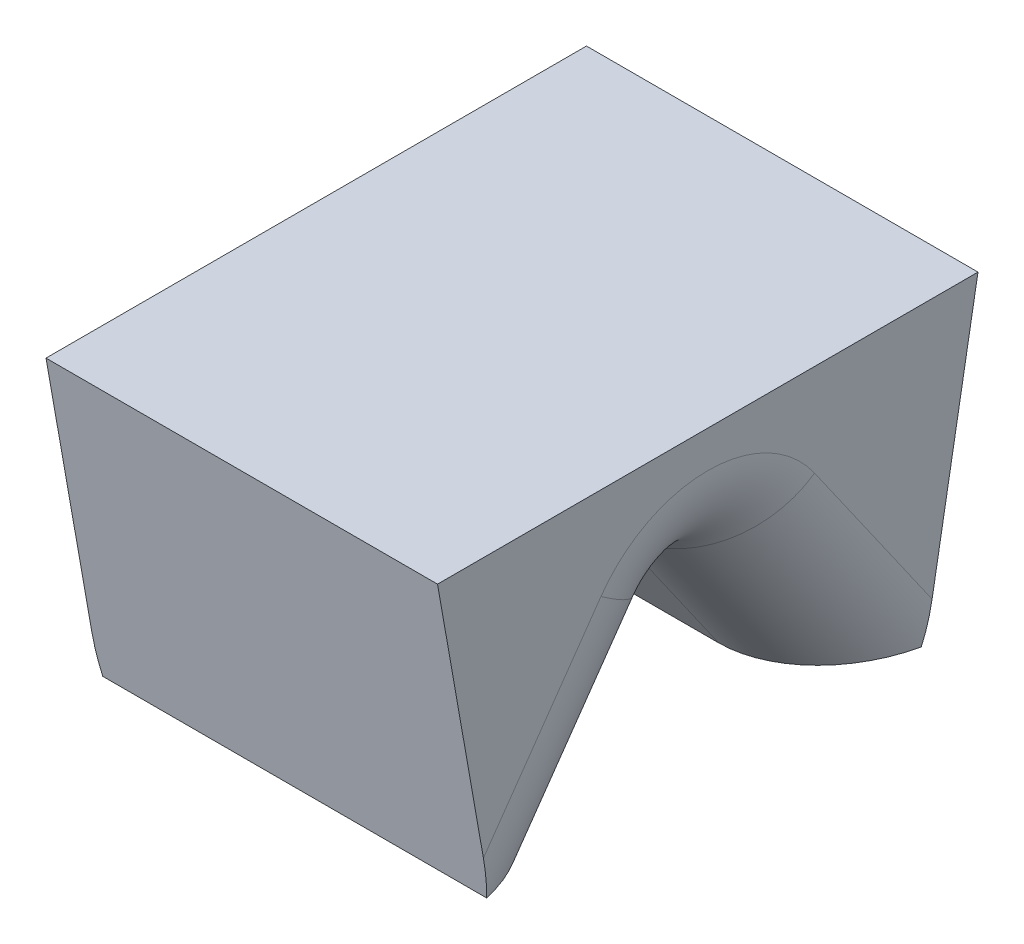
from build123d import *

# Parameters (mm, degrees)
SKETCH_TL_CUTTING_R    = 1.4986
TL_CUTTING_DEPTH       = 29.999999944
SKETCH_TDF_CUTTING_W   = 3.01719996
SKETCH_TDF_CUTTING_H   = 3.01719996
TDF_CUTTING_DEPTH      = 31.074766841
VW_VR_GRINDING_DEPTH   = 1.50859998
VW_VR_GRINDING_2_DEPTH = 1.50859998
ISA_GRINDING_DEPTH     = 1.50859998
SKETCH_PRE_FRX_BRX_W   = 1.220380084
SKETCH_PRE_FRX_BRX_H   = 0.82042
SKETCH_PRE_FRX_BRX_W_2 = 1.24681996
PRE_FRX_BRX_DEPTH      = 1.50859998
FA_BA_GRINDING_DEPTH   = 1.50859998
BR_EDM_R               = 0.14986
FR_EDM_R               = 0.14986
ENGRAVING_DEPTH        = 0.005


with BuildPart() as part:
    # sketch_TL_cutting → TL_cutting (new body)
    with BuildSketch(Plane(origin=(0, 0, 0), x_dir=(1, 0, 0), z_dir=(0, 1, 0))):
        with Locations(Location((0, 0, 0), (0, 0, 270))):
            Circle(SKETCH_TL_CUTTING_R)
    extrude(amount=TL_CUTTING_DEPTH)

    # sketch_TDF_cutting → TDF_cutting (cut, through all)
    with BuildSketch(Plane(origin=(0, 0, 0), x_dir=(1, 0, 0), z_dir=(0, 1, 0))):
        with Locations((-2.71001998, 0)):
            Rectangle(SKETCH_TDF_CUTTING_W, SKETCH_TDF_CUTTING_H)
    extrude(amount=TDF_CUTTING_DEPTH, mode=Mode.SUBTRACT)


with BuildPart() as body_2:
    # sketch_VW_VR_grinding → VW_VR_grinding (new, symmetric)
    with BuildSketch(Plane(origin=(0, 0, 0), x_dir=(0, 0, -1), z_dir=(1, 0, 0))):
        with BuildLine():
            Line((-1.49360001, -0.00999998), (-1.49360001, 0.809308914))
            ThreePointArc((-1.49360001, 0.809308914), (-1.493648337, 0.810415792), (-1.493792952, 0.811514246))
            Line((-1.493792952, 0.811514246), (-1.51859996, 0.952201782))
            Line((-1.51859996, 0.952201782), (-1.50859998, -0.00999998))
            Line((-1.50859998, -0.00999998), (-1.49360001, -0.00999998))
        make_face()
    extrude(amount=VW_VR_GRINDING_DEPTH, both=True)


with BuildPart() as body_3:
    # sketch_VW_VR_grinding → VW_VR_grinding 2 (new, symmetric)
    with BuildSketch(Plane(origin=(0, 0, 0), x_dir=(0, 0, -1), z_dir=(1, 0, 0))):
        with BuildLine():
            Line((1.49360001, -0.00999998), (1.49360001, 0.809308914))
            ThreePointArc((1.49360001, 0.809308914), (1.493648337, 0.810415792), (1.493792952, 0.811514246))
            Line((1.493792952, 0.811514246), (1.51859996, 0.952201782))
            Line((1.51859996, 0.952201782), (1.50859998, -0.00999998))
            Line((1.50859998, -0.00999998), (1.49360001, -0.00999998))
        make_face()
    extrude(amount=VW_VR_GRINDING_2_DEPTH, both=True)


    add(body_2.part)  # ISA_grinding merges body 2
    # sketch_ISA_grinding → ISA_grinding (add, symmetric)
    with BuildSketch(Plane(origin=(0, 0, 0), x_dir=(0, 0, -1), z_dir=(1, 0, 0))):
        Polygon((-0.29972, 0), (0.29972, 0), (1.50859998, 6.855899053), (1.50859998, -0.02999994), (-1.50859998, -0.02999994), (-1.50859998, 6.855899053), align=None)
    extrude(amount=ISA_GRINDING_DEPTH, both=True)

    # sketch_pre_FRX_BRX → pre_FRX_BRX (add, symmetric)
    with BuildSketch(Plane.XY):
        with Locations((0.888409958, 0.40021002)):
            Rectangle(SKETCH_PRE_FRX_BRX_W, SKETCH_PRE_FRX_BRX_H)
        with Locations((-0.89518998, 0.40021002)):
            Rectangle(SKETCH_PRE_FRX_BRX_W_2, SKETCH_PRE_FRX_BRX_H)
    extrude(amount=PRE_FRX_BRX_DEPTH, both=True)

    # sketch_FA_BA_grinding → FA_BA_grinding (add, symmetric)
    with BuildSketch(Plane.XY):
        Polygon((0.268219936, -0.00999998), (0.268219936, 0.82042), (1.6256, 10.478681009), (1.6256, -0.00999998), align=None)
        Polygon((-0.27178, -0.00999998), (-0.27178, 0.82042), (-1.32842, 8.338804263), (-1.32842, -0.00999998), align=None)
    extrude(amount=FA_BA_GRINDING_DEPTH, both=True)


with BuildPart() as part_1:
    add(part.part)

    # B1_fix: cut body 3
    add(body_3.part, mode=Mode.SUBTRACT)

    # V-Groove_EDM: sweep along a path in sketch_contour_V-Groove
    with BuildLine(Plane.XY) as v_groove_edm_path:
        Line((-1.20142, 0.21336), (1.4986, 0.21336))
    # sketch_section_V-Groove → V-Groove_EDM (sweep, cut)
    with BuildSketch(Plane(origin=(-1.20142, 0, -1.2954), x_dir=(0, 0, -1), z_dir=(1, 0, 0))):
        with BuildLine():
            Line((-1.270850039, 0.200580099), (-1.12340028, -0.00999998))
            Line((-1.12340028, -0.00999998), (-1.46739972, -0.00999998))
            Line((-1.46739972, -0.00999998), (-1.319949961, 0.200580099))
            ThreePointArc((-1.319949961, 0.200580099), (-1.2954, 0.21336), (-1.270850039, 0.200580099))
        make_face()
    sweep(path=v_groove_edm_path.line, mode=Mode.SUBTRACT)

    # BR_EDM
    br_edm_edges = [part_1.edges().sort_by_distance(p)[0] for p in [
        (-0.27178, 0.21336, 0),
        (-0.27178, 0.10029005, -0.094773809),
        (-0.27178, 0.10029005, 0.094773809),
    ]]
    fillet(br_edm_edges, radius=BR_EDM_R)

    # FR_EDM
    fr_edm_edges = [part_1.edges().sort_by_distance(p)[0] for p in [
        (0.268219936, 0.10029005, -0.094773809),
        (0.268219936, 0.10029005, 0.094773809),
        (0.268219936, 0.21336, 0),
    ]]
    fillet(fr_edm_edges, radius=FR_EDM_R)

    # sketch_Engraving → Engraving (cut)
    with BuildSketch(Plane.ZY.offset(1.20142)):
        Polygon((-0.347748486, 0.295081019), (-0.475308325, 0.169076788), (-0.664833208, 0.042294753), (-0.91554533, -0.085524354), (-1.231852248, -0.147489398), (-1.486194122, -0.147489398), (-1.802501039, -0.085524354), (-2.055028038, 0.042294753), (-2.24455292, 0.169076788), (-2.372112759, 0.295081019), (-2.35033425, 0.316081724), (-2.227181966, 0.191114565), (-2.041027567, 0.06692521), (-1.791871053, -0.056486342), (-1.48256437, -0.119488457), (-1.235481999, -0.119488457), (-0.926175317, -0.056486342), (-0.678833678, 0.06692521), (-0.492679279, 0.191114565), (-0.369526995, 0.316081724), align=None)
    extrude(amount=-ENGRAVING_DEPTH, mode=Mode.SUBTRACT)

    # SurfaceCut1
    split(bisect_by=Plane(origin=(0, 0.41401793, 0), x_dir=(1, 0, 0), z_dir=(0, 1, 0)), keep=Keep.BOTTOM)


solid = part_1.part
